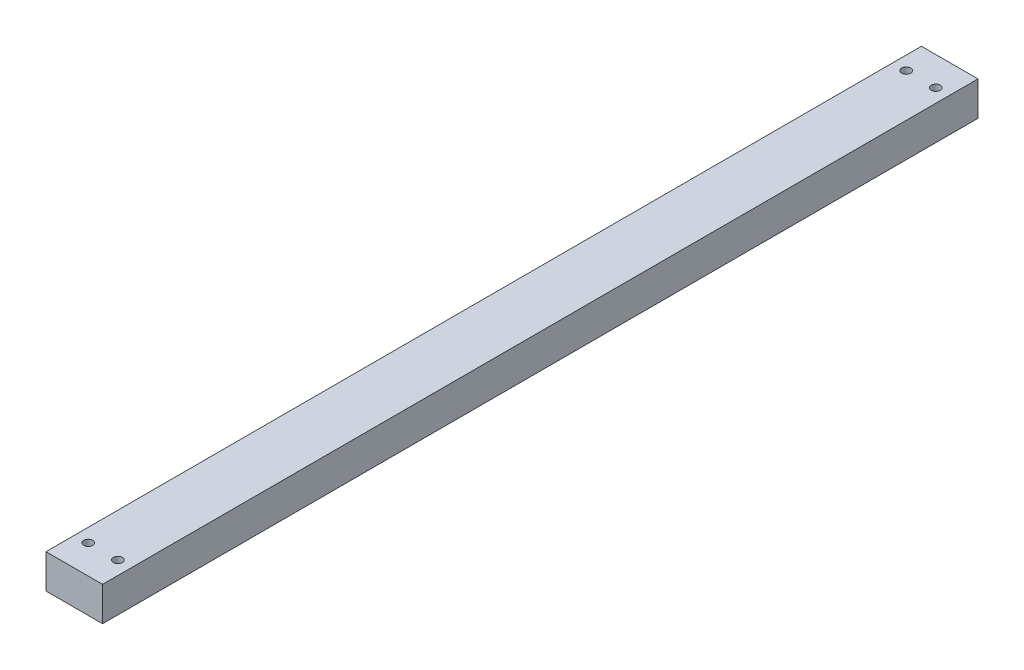
from build123d import *

# Parameters (mm, degrees)
ESQUISSE1_W             = 63
ESQUISSE1_H             = 38
BOSS_EXTRU_1_DEPTH      = 975
ESQUISSE3_R             = 5
ENL_V_MAT_EXTRU_1_DEPTH = 978.771957053


with BuildPart() as part:
    # Esquisse1 → Boss.-Extru.1 (new body)
    with BuildSketch(Plane.XY):
        with Locations((31.5, 19)):
            Rectangle(ESQUISSE1_W, ESQUISSE1_H)
    extrude(amount=BOSS_EXTRU_1_DEPTH)

    # Esquisse3 → Enlèv. mat.-Extru.1 (cut, through all)
    with BuildSketch(Plane(origin=(0, 38, 0), x_dir=(1, 0, 0), z_dir=(0, 1, 0))):
        with Locations(Location((15, -32, 0), (0, 0, 270))):
            Circle(ESQUISSE3_R)
        with Locations(Location((48, -32, 0), (0, 0, 90))):
            Circle(ESQUISSE3_R)
        with Locations(Location((48, -943, 0), (0, 0, 270))):
            Circle(ESQUISSE3_R)
        with Locations(Location((15, -943, 0), (0, 0, 90))):
            Circle(ESQUISSE3_R)
    extrude(amount=-ENL_V_MAT_EXTRU_1_DEPTH, mode=Mode.SUBTRACT)


solid = part.part
